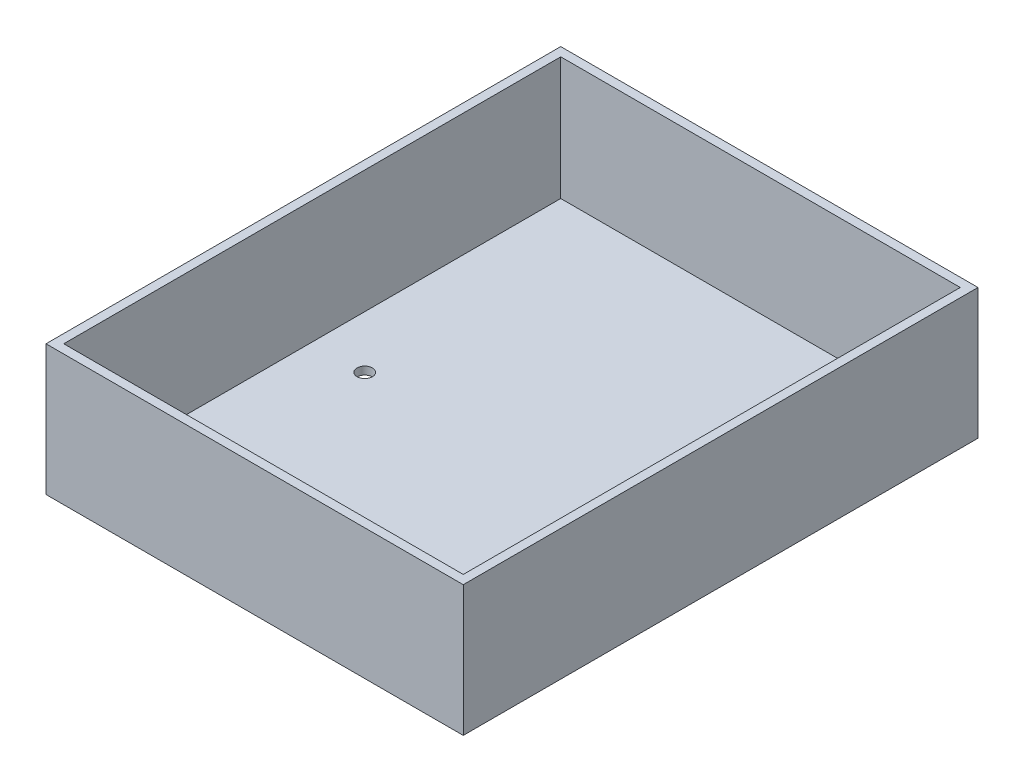
from build123d import *

# Parameters (mm, degrees)
SKETCH1_W           = 61.2
SKETCH1_H           = 75.5
BOSS_EXTRUDE1_DEPTH = 19.15
SKETCH2_W           = 58.6
SKETCH2_H           = 72.89934915
CUT_EXTRUDE1_DEPTH  = 18
SKETCH3_R           = 1.125
CUT_EXTRUDE2_DEPTH  = 20


with BuildPart() as part:
    # Sketch1 → Boss-Extrude1 (new body)
    with BuildSketch(Plane(origin=(0, 0, 0), x_dir=(1, 0, 0), z_dir=(0, 1, 0))):
        Rectangle(SKETCH1_W, SKETCH1_H)
    extrude(amount=BOSS_EXTRUDE1_DEPTH)

    # Sketch2 → Cut-Extrude1 (cut)
    with BuildSketch(Plane(origin=(0, 19.15, 0), x_dir=(1, 0, 0), z_dir=(0, 1, 0))):
        Rectangle(SKETCH2_W, SKETCH2_H)
    extrude(amount=-CUT_EXTRUDE1_DEPTH, mode=Mode.SUBTRACT)

    # Sketch3 → Cut-Extrude2 (cut)
    with BuildSketch(Plane(origin=(0, 1.15, 0), x_dir=(1, 0, 0), z_dir=(0, 1, 0))):
        with Locations(Location((-21.6, 0, 0), (0, 0, 270))):
            Circle(SKETCH3_R)
        with Locations(Location((21.6, 0, 0), (0, 0, 270))):
            Circle(SKETCH3_R)
    extrude(amount=-CUT_EXTRUDE2_DEPTH, mode=Mode.SUBTRACT)


solid = part.part
